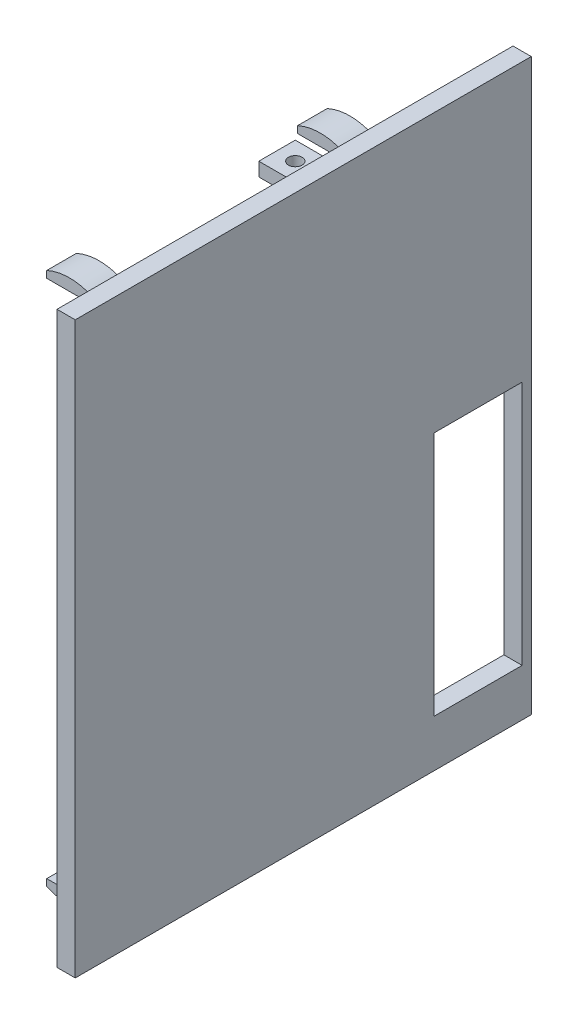
from build123d import *

# Parameters (mm, degrees)
SKETCH2_W               = 4
SKETCH2_H               = 125
BOSS_EXTRUDE2_DEPTH     = 100
CUT_EXTRUDE1_REACH      = 132.347
SKETCH6_W               = 53.8
SKETCH6_H               = 19.347608653
SKETCH9_W               = 6.5
SKETCH9_H               = 1.5
BOSS_EXTRUDE4_DEPTH     = 12.5
BOSS_EXTRUDE5_DEPTH     = 6.5
LPATTERN2_COUNT         = 2
LPATTERN2_PITCH         = 55
MIRROR1_COPY_1_SKETCH_W = 6.5
MIRROR1_COPY_1_SKETCH_H = 1.5
MIRROR1_COPY_1_DEPTH    = 12.5
MIRROR1_COPY_2_DEPTH    = 6.5
SKETCH11_W              = 8
SKETCH11_H              = 3
BOSS_EXTRUDE6_DEPTH     = 10
SKETCH12_R              = 1.5
CUT_EXTRUDE2_DEPTH      = 3


with BuildPart() as part:
    # Sketch2 → Boss-Extrude2 (new body)
    with BuildSketch(Plane.XY):
        with Locations((72.870528802, -53.540266993)):
            Rectangle(SKETCH2_W, SKETCH2_H)
    extrude(amount=BOSS_EXTRUDE2_DEPTH)

    # Sketch6 → Cut-Extrude1 (cut, up to next)
    with BuildSketch(Plane(origin=(70.870528802, -52.340678406, -13.65152284), x_dir=(0, 1, 0), z_dir=(-1, 0, 0)), mode=Mode.PRIVATE) as cut_extrude1_sk1:
        with Locations((-26.429588587, -25.325327166)):
            Rectangle(SKETCH6_W, SKETCH6_H)
    cut_extrude1_tool1 = extrude(cut_extrude1_sk1.sketch, amount=-CUT_EXTRUDE1_REACH, mode=Mode.PRIVATE) & part.part
    add(cut_extrude1_tool1.solids().sort_by_distance((70.870529, -78.770267, 11.673804))[0], mode=Mode.SUBTRACT)

    # Sketch9 → Boss-Extrude4 (add)
    with BuildSketch(Plane.ZY.offset(-70.870528802)):
        with Locations((86.5, -111.290266993)):
            Rectangle(SKETCH9_W, SKETCH9_H)
    boss_extrude4 = extrude(amount=BOSS_EXTRUDE4_DEPTH)

    # Sketch10 → Boss-Extrude5 (add)
    with BuildSketch(Plane.XY.offset(89.75)):
        with BuildLine():
            Line((58.370528802, -112.040266993), (68.370528802, -112.040266993))
            ThreePointArc((68.370528802, -112.040266993), (63.370528802, -113.131554878), (58.370528802, -112.040266993))
        make_face()
    boss_extrude5 = extrude(amount=-BOSS_EXTRUDE5_DEPTH)

    # LPattern2: Boss-Extrude4, Boss-Extrude5 ×2
    with Locations(*[(0, 0, -i * LPATTERN2_PITCH) for i in range(1, LPATTERN2_COUNT)]):
        add(boss_extrude4)
        add(boss_extrude5)

    # Mirror1: Boss-Extrude4, Boss-Extrude5 across plane
    add(boss_extrude4.mirror(Plane.ZX.offset(-53.540266993)))
    add(boss_extrude5.mirror(Plane.ZX.offset(-53.540266993)))

    # Mirror1 copy 1 sketch → Mirror1 copy 1 (add)
    with BuildSketch(Plane(origin=(70.870528802, -107.080533985, -55), x_dir=(0, 0, 1), z_dir=(-1, 0, 0))):
        with Locations((86.5, 111.290266993)):
            Rectangle(MIRROR1_COPY_1_SKETCH_W, MIRROR1_COPY_1_SKETCH_H)
    extrude(amount=MIRROR1_COPY_1_DEPTH)

    # Mirror1 copy 2 sketch → Mirror1 copy 2 (add)
    with BuildSketch(Plane(origin=(0, -107.080533985, 34.75), x_dir=(1, 0, 0), z_dir=(0, 0, 1))):
        with BuildLine():
            Line((58.370528802, 112.040266993), (68.370528802, 112.040266993))
            ThreePointArc((68.370528802, 112.040266993), (63.370528802, 113.131554878), (58.370528802, 112.040266993))
        make_face()
    extrude(amount=-MIRROR1_COPY_2_DEPTH)

    # Sketch11 → Boss-Extrude6 (add)
    with BuildSketch(Plane.ZY.offset(-70.870528802)):
        with Locations((41.75, -110.540266993)):
            Rectangle(SKETCH11_W, SKETCH11_H)
    boss_extrude6 = extrude(amount=BOSS_EXTRUDE6_DEPTH)

    # Sketch12 → Cut-Extrude2 (cut)
    with BuildSketch(Plane(origin=(0, -112.040266993, 0), x_dir=(-1, 0, 0), z_dir=(0, -1, 0))):
        with Locations(Location((-64.870528802, -41.75, 0), (0, 0, 180))):
            Circle(SKETCH12_R)
    cut_extrude2 = extrude(amount=-CUT_EXTRUDE2_DEPTH, mode=Mode.SUBTRACT)

    # Mirror2: Boss-Extrude6, Cut-Extrude2 across plane
    add(boss_extrude6.mirror(Plane.ZX.offset(-53.540266993)))
    add(cut_extrude2.mirror(Plane.ZX.offset(-53.540266993)), mode=Mode.SUBTRACT)


solid = part.part
